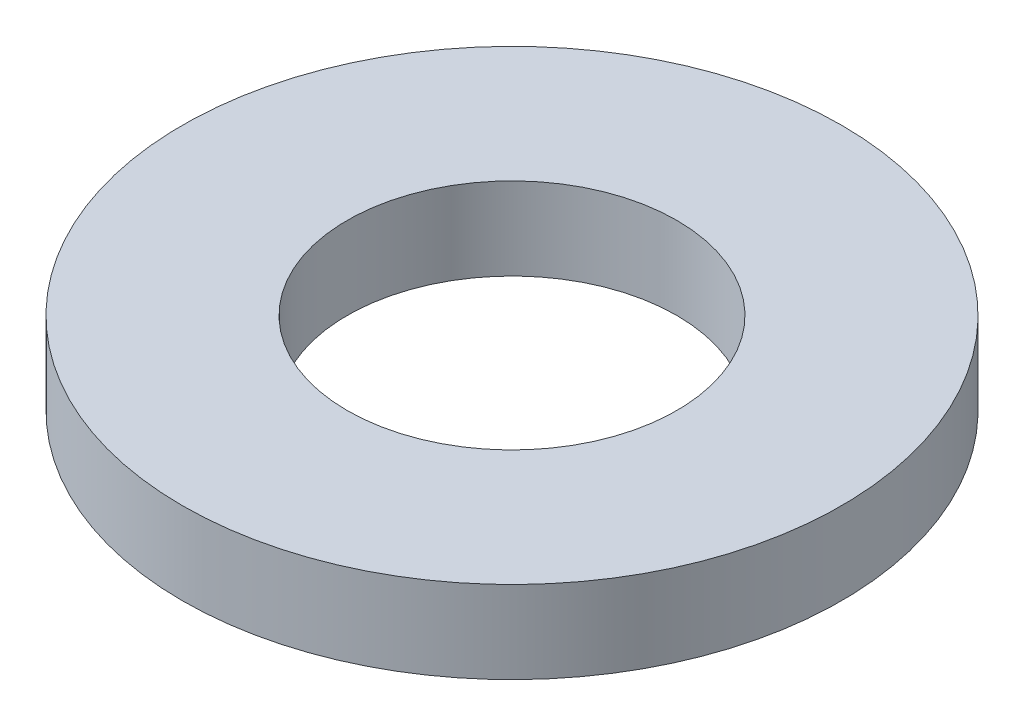
from build123d import *

# Parameters (mm, degrees)
SKETCH_1_R      = 6
SKETCH_1_R_2    = 3
EXTRUDE_1_DEPTH = 1.5


with BuildPart() as part:
    # 草图1 → 凸台-拉伸1 (new body)
    with BuildSketch(Plane(origin=(0, 0, 0), x_dir=(1, 0, 0), z_dir=(0, 1, 0))):
        with Locations(Location((0, 0, 0), (0, 0, 270))):
            Circle(SKETCH_1_R)
        with Locations(Location((0, 0, 0), (0, 0, 270))):
            Circle(SKETCH_1_R_2, mode=Mode.SUBTRACT)
    extrude(amount=EXTRUDE_1_DEPTH)


solid = part.part
